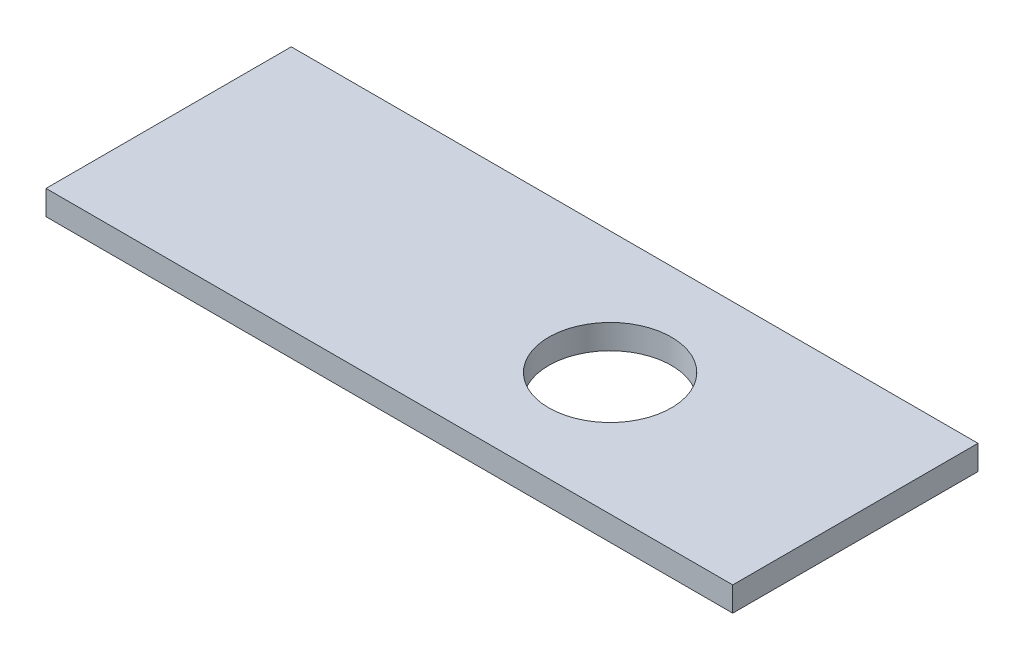
from build123d import *

# Parameters (mm, degrees)
SKETCH_1_W      = 28
SKETCH_1_H      = 10
SKETCH_1_R      = 2.5
EXTRUDE_1_DEPTH = 1


with BuildPart() as part:
    # 草图1 → 凸台-拉伸1 (new body)
    with BuildSketch(Plane(origin=(0, 0, 0), x_dir=(1, 0, 0), z_dir=(0, 1, 0))):
        with Locations((-6, 0)):
            Rectangle(SKETCH_1_W, SKETCH_1_H)
        with Locations(Location((-2, 0, 0), (0, 0, 270))):
            Circle(SKETCH_1_R, mode=Mode.SUBTRACT)
    extrude(amount=EXTRUDE_1_DEPTH)


solid = part.part
